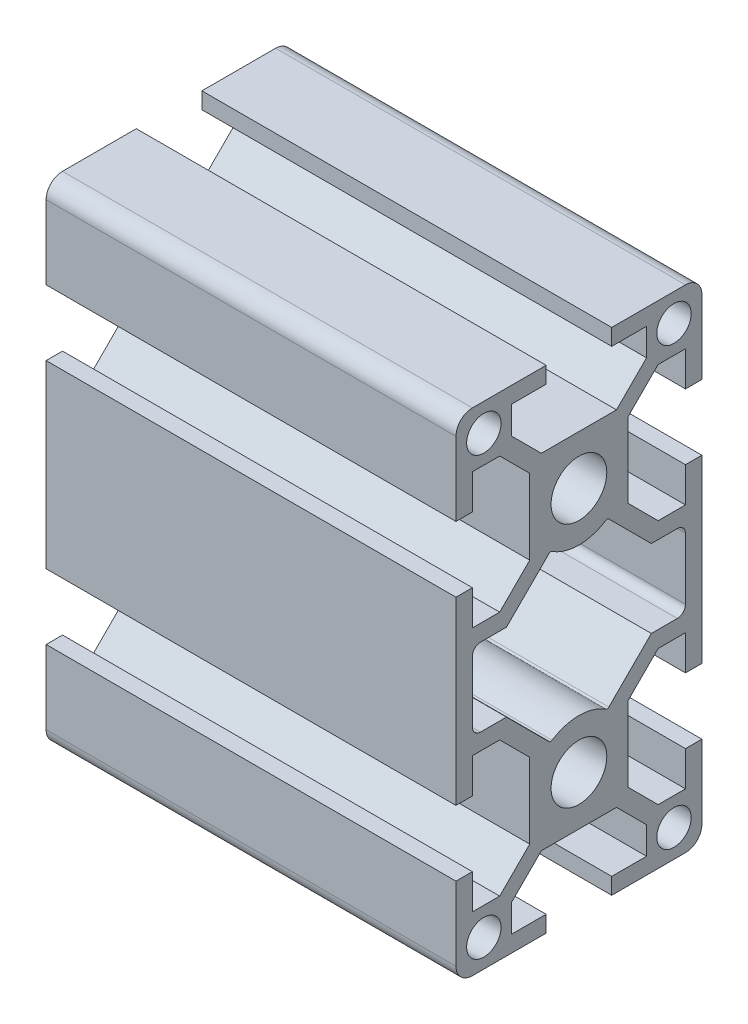
from build123d import *

# Parameters (mm, degrees)
SKETCH1_R           = 2.1
SKETCH1_R_2         = 3.4
BOSS_EXTRUDE1_DEPTH = 50


with BuildPart() as part:
    # Sketch1 → Boss-Extrude1 (new body)
    with BuildSketch(Plane(origin=(0, 0, 0), x_dir=(0, 0, -1), z_dir=(1, 0, 0))):
        with BuildLine():
            Line((-15, 28), (-15, 19))
            Line((-15, 19), (-13, 19))
            Line((-13, 19), (-13, 23.25))
            Line((-13, 23.25), (-9.664213562, 23.25))
            Line((-9.664213562, 23.25), (-6, 19.585786438))
            Line((-6, 19.585786438), (-6, 10.414213562))
            Line((-6, 10.414213562), (-9.664213562, 6.75))
            Line((-9.664213562, 6.75), (-13, 6.75))
            Line((-13, 6.75), (-13, 11))
            Line((-13, 11), (-15, 11))
            Line((-15, 11), (-15, -11))
            Line((-15, -11), (-13, -11))
            Line((-13, -11), (-13, -6.75))
            Line((-13, -6.75), (-9.664213562, -6.75))
            Line((-9.664213562, -6.75), (-6, -10.414213562))
            Line((-6, -10.414213562), (-6, -19.585786438))
            Line((-6, -19.585786438), (-9.664213562, -23.25))
            Line((-9.664213562, -23.25), (-13, -23.25))
            Line((-13, -23.25), (-13, -19))
            Line((-13, -19), (-15, -19))
            Line((-15, -19), (-15, -28))
            ThreePointArc((-15, -28), (-14.414213562, -29.414213562), (-13, -30))
            Line((-13, -30), (-4, -30))
            Line((-4, -30), (-4, -28))
            Line((-4, -28), (-8.25, -28))
            Line((-8.25, -28), (-8.25, -24.664213562))
            Line((-8.25, -24.664213562), (-4.585786438, -21))
            Line((-4.585786438, -21), (4.585786438, -21))
            Line((4.585786438, -21), (8.25, -24.664213562))
            Line((8.25, -24.664213562), (8.25, -28))
            Line((8.25, -28), (4, -28))
            Line((4, -28), (4, -30))
            Line((4, -30), (13, -30))
            ThreePointArc((13, -30), (14.414213562, -29.414213562), (15, -28))
            Line((15, -28), (15, -19))
            Line((15, -19), (13, -19))
            Line((13, -19), (13, -23.25))
            Line((13, -23.25), (9.664213562, -23.25))
            Line((9.664213562, -23.25), (6, -19.585786438))
            Line((6, -19.585786438), (6, -10.414213562))
            Line((6, -10.414213562), (9.664213562, -6.75))
            Line((9.664213562, -6.75), (13, -6.75))
            Line((13, -6.75), (13, -11))
            Line((13, -11), (15, -11))
            Line((15, -11), (15, 11))
            Line((15, 11), (13, 11))
            Line((13, 11), (13, 6.75))
            Line((13, 6.75), (9.664213562, 6.75))
            Line((9.664213562, 6.75), (6, 10.414213562))
            Line((6, 10.414213562), (6, 19.585786438))
            Line((6, 19.585786438), (9.664213562, 23.25))
            Line((9.664213562, 23.25), (13, 23.25))
            Line((13, 23.25), (13, 19))
            Line((13, 19), (15, 19))
            Line((15, 19), (15, 28))
            ThreePointArc((15, 28), (14.414213562, 29.414213562), (13, 30))
            Line((13, 30), (4, 30))
            Line((4, 30), (4, 28))
            Line((4, 28), (8.25, 28))
            Line((8.25, 28), (8.25, 24.664213562))
            Line((8.25, 24.664213562), (4.585786438, 21))
            Line((4.585786438, 21), (-4.585786438, 21))
            Line((-4.585786438, 21), (-8.25, 24.664213562))
            Line((-8.25, 24.664213562), (-8.25, 28))
            Line((-8.25, 28), (-4, 28))
            Line((-4, 28), (-4, 30))
            Line((-4, 30), (-13, 30))
            ThreePointArc((-13, 30), (-14.414213562, 29.414213562), (-15, 28))
        make_face()
        with Locations((-11.6, 26.625)):
            Circle(SKETCH1_R, mode=Mode.SUBTRACT)
        with Locations((0, 15)):
            Circle(SKETCH1_R_2, mode=Mode.SUBTRACT)
        with Locations((11.6, 26.625)):
            Circle(SKETCH1_R, mode=Mode.SUBTRACT)
        with Locations((0, -15)):
            Circle(SKETCH1_R_2, mode=Mode.SUBTRACT)
        with Locations((-11.6, -26.625)):
            Circle(SKETCH1_R, mode=Mode.SUBTRACT)
        with Locations((11.6, -26.625)):
            Circle(SKETCH1_R, mode=Mode.SUBTRACT)
        with BuildLine():
            Line((-8.835786438, 4.75), (-12, 4.75))
            ThreePointArc((-12, 4.75), (-12.707106781, 4.457106781), (-13, 3.75))
            Line((-13, 3.75), (-13, -3.75))
            ThreePointArc((-13, -3.75), (-12.707106781, -4.457106781), (-12, -4.75))
            Line((-12, -4.75), (-8.835786438, -4.75))
            Line((-8.835786438, -4.75), (-3.651792162, -9.933994275))
            ThreePointArc((-3.651792162, -9.933994275), (-3.470780401, -10.020243756), (-3.275866789, -9.973202134))
            ThreePointArc((-3.275866789, -9.973202134), (0, -9), (3.275866789, -9.973202134))
            ThreePointArc((3.275866789, -9.973202134), (3.470780401, -10.020243756), (3.651792162, -9.933994275))
            Line((3.651792162, -9.933994275), (8.835786438, -4.75))
            Line((8.835786438, -4.75), (12, -4.75))
            ThreePointArc((12, -4.75), (12.707106781, -4.457106781), (13, -3.75))
            Line((13, -3.75), (13, 3.75))
            ThreePointArc((13, 3.75), (12.707106781, 4.457106781), (12, 4.75))
            Line((12, 4.75), (8.835786438, 4.75))
            Line((8.835786438, 4.75), (3.651792162, 9.933994275))
            ThreePointArc((3.651792162, 9.933994275), (3.470780401, 10.020243756), (3.275866789, 9.973202134))
            ThreePointArc((3.275866789, 9.973202134), (0, 9), (-3.275866789, 9.973202134))
            ThreePointArc((-3.275866789, 9.973202134), (-3.470780401, 10.020243756), (-3.651792162, 9.933994275))
            Line((-3.651792162, 9.933994275), (-8.835786438, 4.75))
        make_face(mode=Mode.SUBTRACT)
    extrude(amount=BOSS_EXTRUDE1_DEPTH)


solid = part.part
